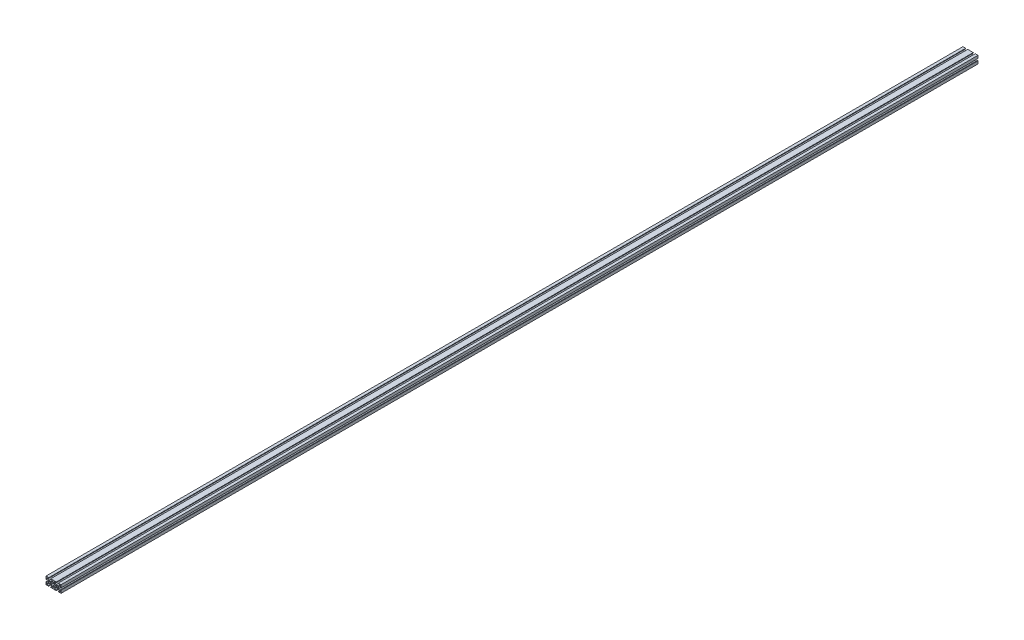
from build123d import *

# Parameters (mm, degrees)
SKETCH1_R           = 2.095
BOSS_EXTRUDE1_DEPTH = 2440
LPATTERN1_COUNT     = 2
LPATTERN1_PITCH     = 20


with BuildPart() as part:
    # Sketch1 → Boss-Extrude1 (new body)
    with BuildSketch(Plane.XY):
        Polygon((6.345, 12.594339828), (1.5, 17.439339828), (1.5, 12.63), (0, 12.63), (0, 20), (7.37, 20), (7.37, 18.5), (2.560660172, 18.5), (7.405660172, 13.655), (12.594339828, 13.655), (17.439339828, 18.5), (12.63, 18.5), (12.63, 20), (20, 20), (20, 12.63), (18.5, 12.63), (18.5, 17.439339828), (13.655, 12.594339828), (13.655, 7.405660172), (18.5, 2.560660172), (18.5, 7.37), (20, 7.37), (20, 0), (12.63, 0), (12.63, 1.5), (17.439339828, 1.5), (12.594339828, 6.345), (7.405660172, 6.345), (2.560660172, 1.5), (7.37, 1.5), (7.37, 0), (0, 0), (0, 7.37), (1.5, 7.37), (1.5, 2.560660172), (6.345, 7.405660172), align=None)
        with Locations((10, 10)):
            Circle(SKETCH1_R, mode=Mode.SUBTRACT)
    boss_extrude1 = extrude(amount=BOSS_EXTRUDE1_DEPTH)

    # LPattern1: Boss-Extrude1 ×2
    with Locations(*[(i * LPATTERN1_PITCH, 0, 0) for i in range(1, LPATTERN1_COUNT)]):
        add(boss_extrude1)


solid = part.part
